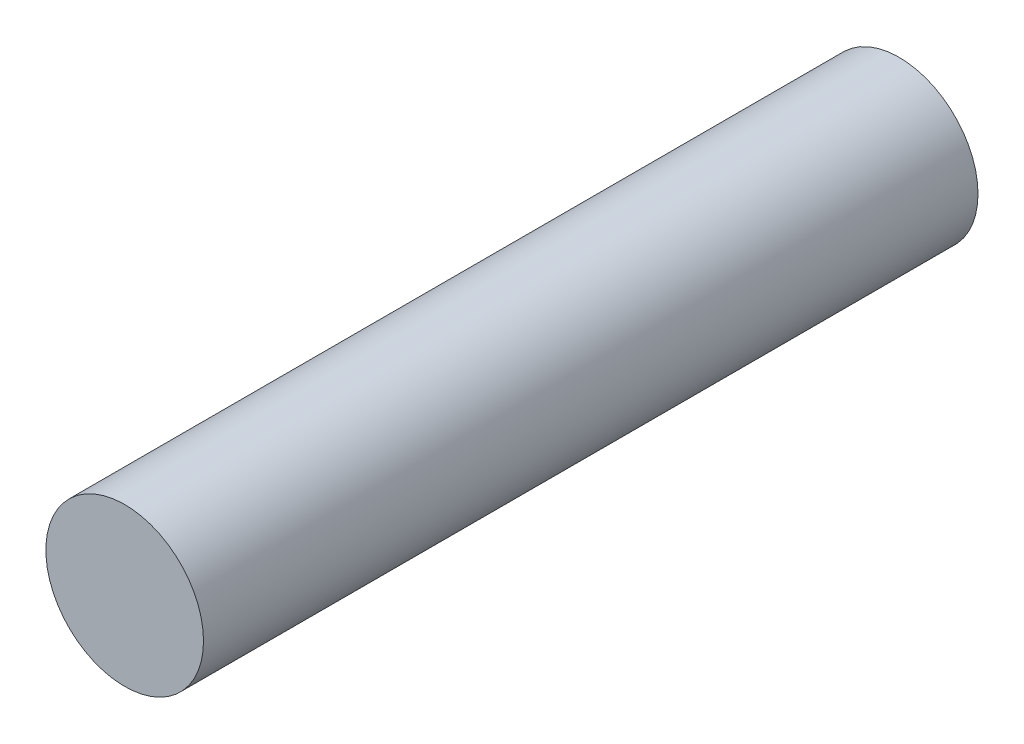
from build123d import *

# Parameters (mm, degrees)
SKETCH1_R           = 2
BOSS_EXTRUDE1_DEPTH = 19.65


with BuildPart() as part:
    # Sketch1 → Boss-Extrude1 (new body)
    with BuildSketch(Plane.XY):
        Circle(SKETCH1_R)
    extrude(amount=BOSS_EXTRUDE1_DEPTH)


solid = part.part
